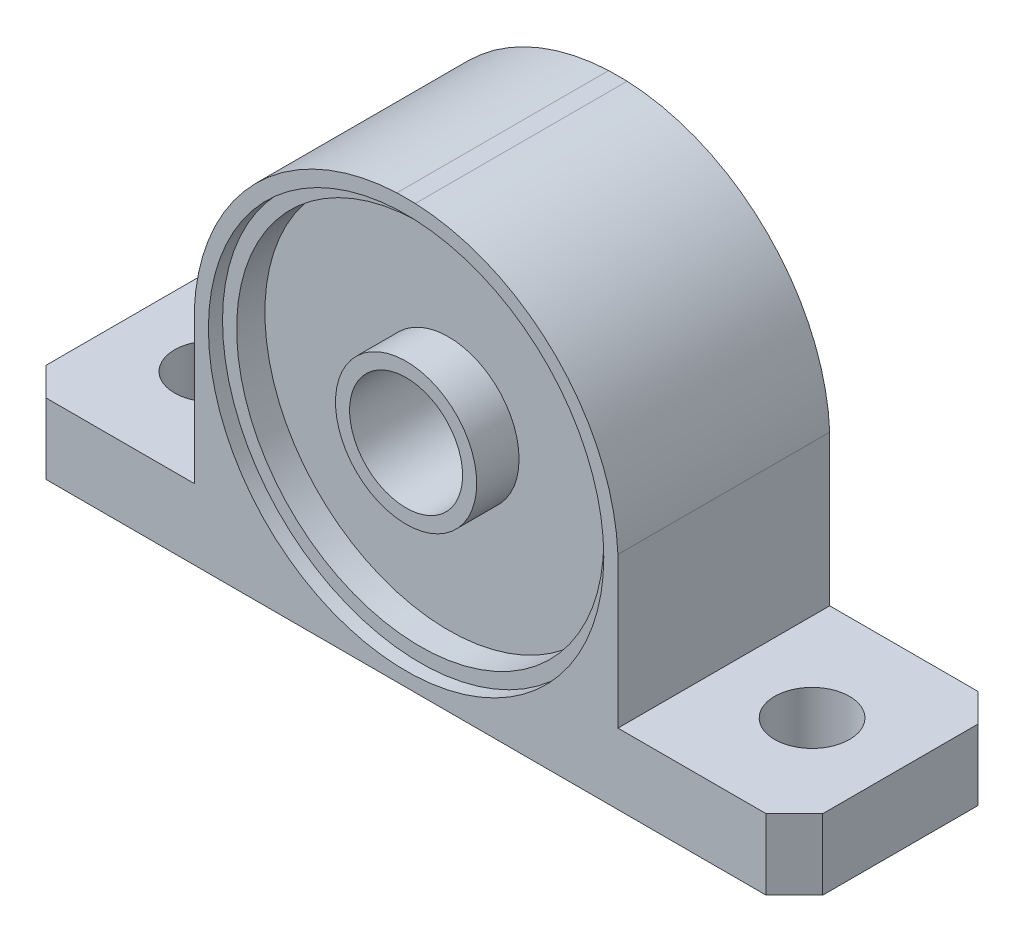
from build123d import *

# Parameters (mm, degrees)
BOSS_EXTRUDE1_DEPTH     = 5
SKETCH2_W               = 30
SKETCH2_H               = 15
BOSS_EXTRUDE2_DEPTH     = 25
CUT_EXTRUDE1_DEPTH      = 44.373378932
SKETCH3_3_R             = 14
SKETCH3_3_R_2           = 13
CUT_EXTRUDE2_DEPTH      = 1
CUT_EXTRUDE3_DEPTH      = 44.373378932
CUT_EXTRUDE3_DEPTH_BACK = 44.373378932
SKETCH3_4_R             = 4
SKETCH3_5_R             = 13
SKETCH3_5_R_2           = 5
CUT_EXTRUDE4_DEPTH      = 3
CUT_EXTRUDE5_START      = 3
SKETCH5_R               = 13
SKETCH5_R_2             = 5
CUT_EXTRUDE5_DEPTH      = 3
CUT_EXTRUDE8_START      = 1
SKETCH5_8_R             = 14
SKETCH5_8_R_2           = 13
CUT_EXTRUDE8_DEPTH      = 1
CUT_EXTRUDE9_START      = 2
SKETCH5_9_R             = 5
SKETCH5_9_R_2           = 4
CUT_EXTRUDE9_DEPTH      = 2
SKETCH6_R               = 2.65
CUT_EXTRUDE10_DEPTH     = 38.91437722


with BuildPart() as part:
    # Sketch1 → Boss-Extrude1 (new body)
    with BuildSketch(Plane(origin=(0, 0, 0), x_dir=(1, 0, 0), z_dir=(0, 1, 0))):
        Polygon((25.5, 7.5), (27.5, 5.5), (27.5, -5.5), (25.5, -7.5), (-25.5, -7.5), (-27.5, -5.5), (-27.5, 5.5), (-25.5, 7.5), align=None)
    extrude(amount=BOSS_EXTRUDE1_DEPTH)

    # Sketch2 → Boss-Extrude2 (add)
    with BuildSketch(Plane(origin=(0, 5, 0), x_dir=(1, 0, 0), z_dir=(0, 1, 0))):
        Rectangle(SKETCH2_W, SKETCH2_H)
    extrude(amount=BOSS_EXTRUDE2_DEPTH)

    # Sketch3 → Cut-Extrude1 (cut, through all)
    with BuildSketch(Plane.XY.offset(7.5)):
        with BuildLine():
            Line((-15, 30), (-15, 15.652790041))
            ThreePointArc((-15, 15.652790041), (-10.616641061, 25.616641061), (-0.652790041, 30))
            Line((-0.652790041, 30), (-15, 30))
        make_face()
        with BuildLine():
            ThreePointArc((0.652790041, 30), (10.616641061, 25.616641061), (15, 15.652790041))
            Line((15, 15.652790041), (15, 30))
            Line((15, 30), (0.652790041, 30))
        make_face()
    extrude(amount=-CUT_EXTRUDE1_DEPTH, mode=Mode.SUBTRACT)

    # Sketch3<3> → Cut-Extrude2 (cut)
    with BuildSketch(Plane.XY.offset(7.5)):
        with Locations((0, 15)):
            Circle(SKETCH3_3_R)
        with Locations((0, 15)):
            Circle(SKETCH3_3_R_2, mode=Mode.SUBTRACT)
    extrude(amount=-CUT_EXTRUDE2_DEPTH, mode=Mode.SUBTRACT)

    # Sketch3<4> → Cut-Extrude3 (cut, two sides: drawn at the far end of the back side and taken through both)
    with BuildSketch(Plane.XY.offset(7.5).offset(-CUT_EXTRUDE3_DEPTH_BACK)):
        with Locations((0, 15)):
            Circle(SKETCH3_4_R)
    extrude(amount=CUT_EXTRUDE3_DEPTH + CUT_EXTRUDE3_DEPTH_BACK, mode=Mode.SUBTRACT)

    # Sketch3<5> → Cut-Extrude4 (cut)
    with BuildSketch(Plane.XY.offset(7.5)):
        with Locations((0, 15)):
            Circle(SKETCH3_5_R)
        with Locations((0, 15)):
            Circle(SKETCH3_5_R_2, mode=Mode.SUBTRACT)
    extrude(amount=-CUT_EXTRUDE4_DEPTH, mode=Mode.SUBTRACT)

    # Sketch5 → Cut-Extrude5 (cut)
    with BuildSketch(Plane.XY.offset(-7.5).offset(CUT_EXTRUDE5_START)):
        with Locations((0, 15)):
            Circle(SKETCH5_R)
        with Locations((0, 15)):
            Circle(SKETCH5_R_2, mode=Mode.SUBTRACT)
    extrude(amount=-CUT_EXTRUDE5_DEPTH, mode=Mode.SUBTRACT)

    # Sketch5<8> → Cut-Extrude8 (cut)
    with BuildSketch(Plane.XY.offset(-7.5).offset(CUT_EXTRUDE8_START)):
        with Locations((0, 15)):
            Circle(SKETCH5_8_R)
        with Locations(Location((0, 15, 0), (0, 0, 180))):
            Circle(SKETCH5_8_R_2, mode=Mode.SUBTRACT)
    extrude(amount=-CUT_EXTRUDE8_DEPTH, mode=Mode.SUBTRACT)

    # Sketch5<9> → Cut-Extrude9 (cut)
    with BuildSketch(Plane.XY.offset(-7.5).offset(CUT_EXTRUDE9_START)):
        with Locations(Location((0, 15, 0), (0, 0, 180))):
            Circle(SKETCH5_9_R)
        with Locations((0, 15)):
            Circle(SKETCH5_9_R_2, mode=Mode.SUBTRACT)
    extrude(amount=-CUT_EXTRUDE9_DEPTH, mode=Mode.SUBTRACT)

    # Sketch6 → Cut-Extrude10 (cut, through all)
    with BuildSketch(Plane(origin=(0, 5, 0), x_dir=(1, 0, 0), z_dir=(0, 1, 0))):
        with Locations(Location((-21.25, 0, 0), (0, 0, 270))):
            Circle(SKETCH6_R)
        with Locations(Location((21.25, 0, 0), (0, 0, 270))):
            Circle(SKETCH6_R)
    extrude(amount=-CUT_EXTRUDE10_DEPTH, mode=Mode.SUBTRACT)


solid = part.part
